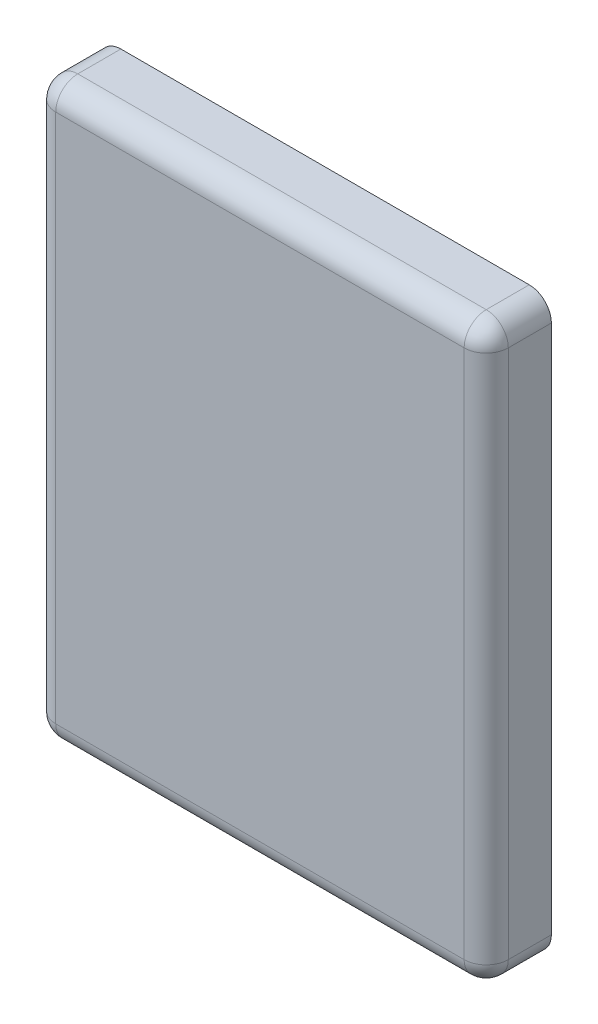
from build123d import *

# Parameters (mm, degrees)
CROQUIS1_W              = 520
CROQUIS1_H              = 410
SALIENTE_EXTRUIR1_DEPTH = 9
CROQUIS2_W              = 410
CROQUIS2_H              = 520
SALIENTE_EXTRUIR2_DEPTH = 50
REDONDEO1_R             = 20


with BuildPart() as part:
    # Croquis1 → Saliente-Extruir1 (new body)
    with BuildSketch(Plane(origin=(0, 0, 0), x_dir=(0, 1, 0), z_dir=(0, 0, 1))):
        Rectangle(CROQUIS1_W, CROQUIS1_H)
    extrude(amount=SALIENTE_EXTRUIR1_DEPTH)

    # Croquis2 → Saliente-Extruir2 (add)
    with BuildSketch(Plane.XY.offset(9)):
        Rectangle(CROQUIS2_W, CROQUIS2_H)
    extrude(amount=SALIENTE_EXTRUIR2_DEPTH)

    # Redondeo1
    redondeo1_edges = [part.edges().sort_by_distance(p)[0] for p in [
        (205, 0, 59),
        (0, 260, 59),
        (-205, 0, 59),
        (0, -260, 59),
        (205, 260, 29.5),
        (205, -260, 29.5),
        (-205, -260, 29.5),
        (-205, 260, 29.5),
    ]]
    fillet(redondeo1_edges, radius=REDONDEO1_R)


solid = part.part
